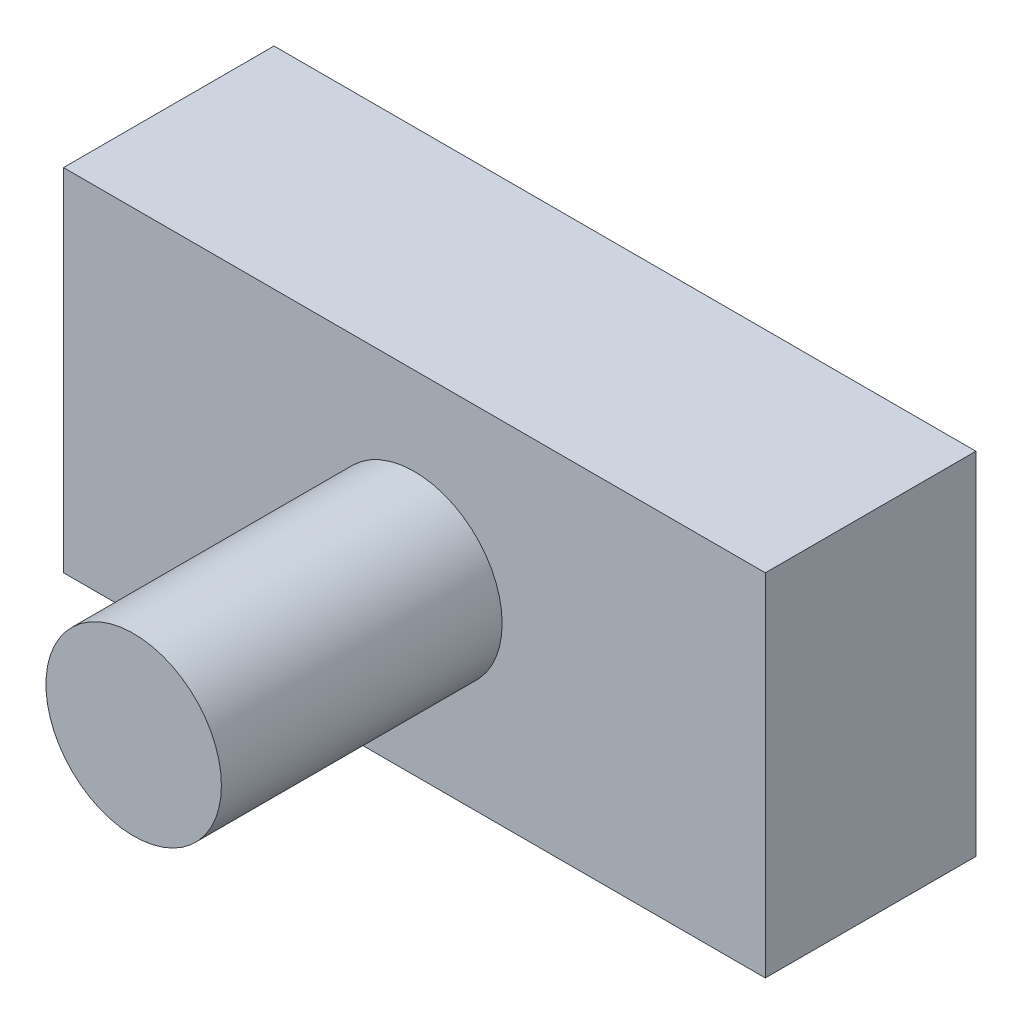
from build123d import *

# Parameters (mm, degrees)
SKETCH1_W           = 200
SKETCH1_H           = 100
BOSS_EXTRUDE1_DEPTH = 60
SKETCH2_R           = 25
BOSS_EXTRUDE2_DEPTH = 80


with BuildPart() as part:
    # Sketch1 → Boss-Extrude1 (new body)
    with BuildSketch(Plane.XY):
        with Locations((100, 50)):
            Rectangle(SKETCH1_W, SKETCH1_H)
    extrude(amount=BOSS_EXTRUDE1_DEPTH)

    # Sketch2 → Boss-Extrude2 (add)
    with BuildSketch(Plane.XY.offset(60)):
        with Locations((100, 50)):
            Circle(SKETCH2_R)
    extrude(amount=BOSS_EXTRUDE2_DEPTH)


solid = part.part
